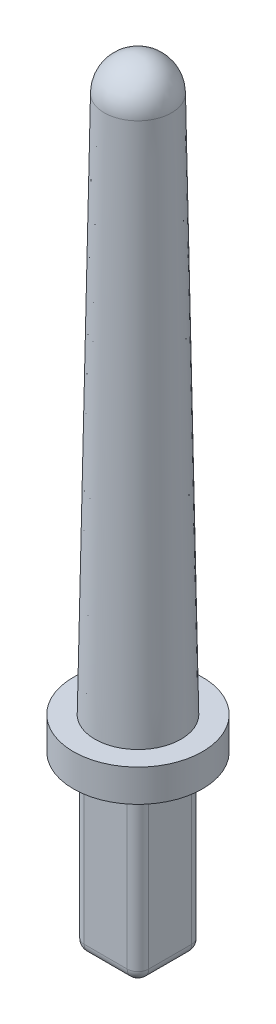
from build123d import *

# Parameters (mm, degrees)
SKETCH10_W         = 3
SKETCH10_H         = 3
HANDLE_DEPTH       = 8
SKETCH13_R         = 3
GUARD_DEPTH        = 1.5
SKETCH11_R         = 2
BLADE_DEPTH        = 25
BLADE_TAPER        = 1
BLADE_TIP_ANGLE    = 180
EASY_HAND_INSERT_R = 0.5
SCALE1_SCALE       = 2


with BuildPart() as part:
    # Sketch10 → Handle (new body)
    with BuildSketch(Plane(origin=(0, 0, 0), x_dir=(1, 0, 0), z_dir=(0, 1, 0))):
        Rectangle(SKETCH10_W, SKETCH10_H)
    extrude(amount=HANDLE_DEPTH)

    # Sketch13 → Guard (add)
    with BuildSketch(Plane(origin=(0, 8, 0), x_dir=(1, 0, 0), z_dir=(0, 1, 0))):
        with Locations(Location((0, 0, 0), (0, 0, 270))):
            Circle(SKETCH13_R)
    extrude(amount=GUARD_DEPTH)

    # Sketch11 → Blade (add)
    with BuildSketch(Plane(origin=(0, 9.5, 0), x_dir=(1, 0, 0), z_dir=(0, 1, 0))):
        Circle(SKETCH11_R)
    extrude(amount=BLADE_DEPTH, taper=BLADE_TAPER)

    # Sketch12 → Blade tip (revolve)
    with BuildSketch(Plane(origin=(0, 34.5, 0), x_dir=(1, 0, 0), z_dir=(0, 1, 0))):
        with BuildLine():
            Line((0, -1.563623377), (0, 1.563623377))
            ThreePointArc((0, 1.563623377), (-1.563623377, 0), (0, -1.563623377))
        make_face()
    revolve(axis=Axis((0, 34.5, 0), (0, 0, -1)), revolution_arc=BLADE_TIP_ANGLE)

    # Easy hand insert
    easy_hand_insert_edges = [part.edges().sort_by_distance(p)[0] for p in [
        (0, 0, 1.5),
        (-1.5, 0, 0),
        (0, 0, -1.5),
        (1.5, 0, 0),
        (1.5, 4, 1.5),
        (-1.5, 4, 1.5),
        (-1.5, 4, -1.5),
        (1.5, 4, -1.5),
    ]]
    fillet(easy_hand_insert_edges, radius=EASY_HAND_INSERT_R)


with BuildPart() as part_1:
    # Scale1: scaled about (0, 16.701239366, 0)
    add(part.part.scale(SCALE1_SCALE).moved(Location((0, -16.701239366, 0))))


solid = part_1.part
